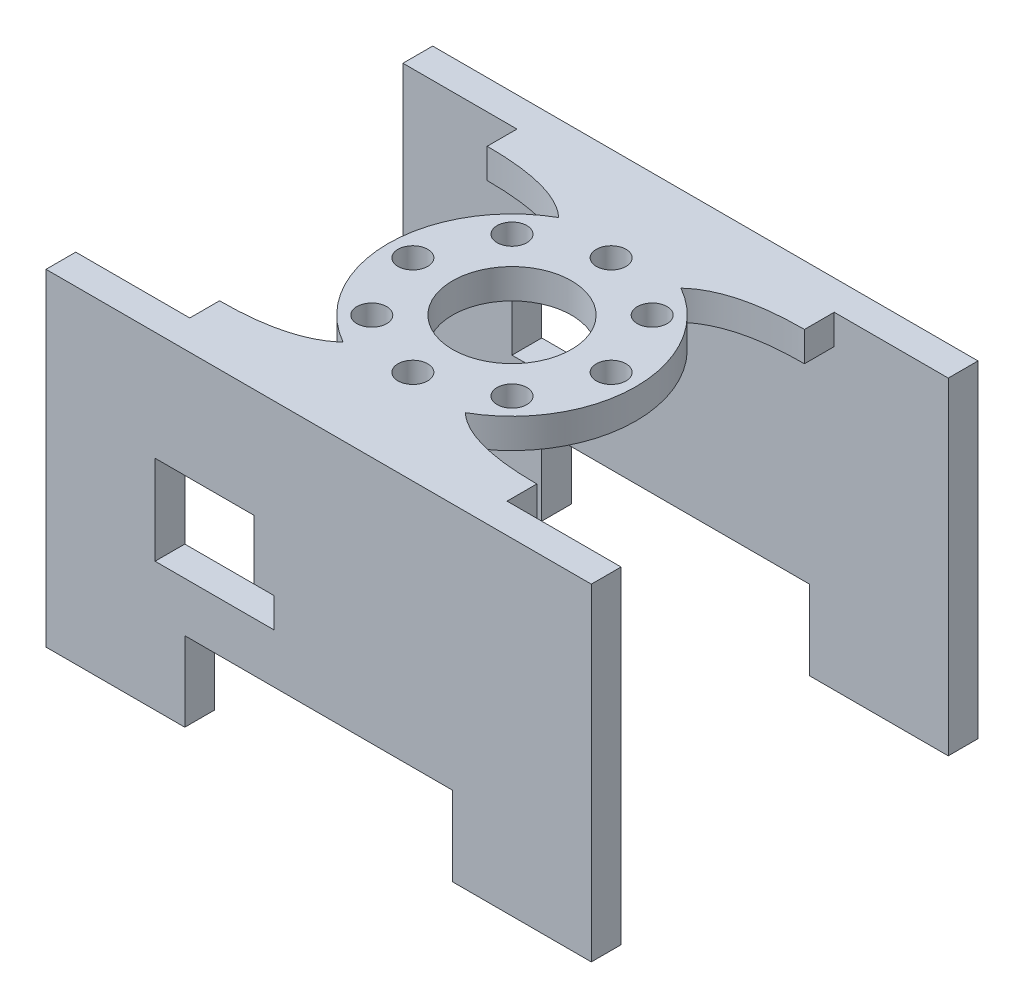
from build123d import *

# Parameters (mm, degrees)
ESQUISSE1_W                = 55
ESQUISSE1_H                = 33
BOSS_EXTRU_1_DEPTH         = 3
ENL_V_MAT_EXTRU_1_REACH    = 66.211
ENL_V_MAT_EXTRU_2_REACH    = 66.211
ESQUISSE4_W                = 32
ESQUISSE4_H                = 3
BOSS_EXTRU_2_DEPTH         = 3
ENL_V_MAT_EXTRU_3_REACH    = 74.132
ESQUISSE5_R                = 1.5
R_P_TITION_LIN_AIRE1_COUNT = 2
R_P_TITION_LIN_AIRE1_PITCH = 36


with BuildPart() as part:
    # Esquisse1 → Boss.-Extru.1 (new body)
    with BuildSketch(Plane.XY):
        with Locations((27.5, 16.5)):
            Rectangle(ESQUISSE1_W, ESQUISSE1_H)
    boss_extru_1 = extrude(amount=BOSS_EXTRU_1_DEPTH)

    # Esquisse2 → Enlèv. mat.-Extru.1 (cut, up to next)
    with BuildSketch(Plane.XY.offset(3), mode=Mode.PRIVATE) as enl_v_mat_extru_1_sk1:
        Polygon((27.5, 8), (41, 8), (41, 0), (14, 0), (14, 8), align=None)
    enl_v_mat_extru_1_tool1 = extrude(enl_v_mat_extru_1_sk1.sketch, amount=-ENL_V_MAT_EXTRU_1_REACH, mode=Mode.PRIVATE) & part.part
    enl_v_mat_extru_1 = enl_v_mat_extru_1_tool1.solids().sort_by_distance((27.5, 4, 3))[0]
    add(enl_v_mat_extru_1, mode=Mode.SUBTRACT)

    # Esquisse3 → Enlèv. mat.-Extru.2 (cut, up to next)
    with BuildSketch(Plane.XY.offset(3), mode=Mode.PRIVATE) as enl_v_mat_extru_2_sk1:
        Polygon((11, 22), (21, 22), (21, 16), (23, 16), (23, 13), (11, 13), (11, 16), align=None)
    enl_v_mat_extru_2_tool1 = extrude(enl_v_mat_extru_2_sk1.sketch, amount=-ENL_V_MAT_EXTRU_2_REACH, mode=Mode.PRIVATE) & part.part
    enl_v_mat_extru_2 = enl_v_mat_extru_2_tool1.solids().sort_by_distance((16.375, 17.3125, 3))[0]
    add(enl_v_mat_extru_2, mode=Mode.SUBTRACT)

    # Esquisse4 → Boss.-Extru.2 (add)
    with BuildSketch(Plane(origin=(0, 33, 0), x_dir=(1, 0, 0), z_dir=(0, 1, 0))):
        Polygon((11.5, 0), (27.5, 0), (43.5, 0), (43.5, 3), (11.5, 3), align=None)
        with BuildLine():
            add(Edge.make_bspline(
                [(11.5, 3), (18.557221365, 3), (21.334379392, 5.626402504)],
                knots=[0, 0, 0, 0.441076335, 0.441076335, 0.441076335], degree=2))
            Line((11.5, 3), (43.5, 3))
            add(Edge.make_bspline(
                [(43.5, 3), (36.442778635, 3), (33.665620608, 5.626402504)],
                knots=[0, 0, 0, 0.441076335, 0.441076335, 0.441076335], degree=2))
            ThreePointArc((33.665620608, 5.626402504), (27.5, 4), (21.334379392, 5.626402504))
        make_face()
        with BuildLine():
            add(Edge.make_bspline(
                [(21.334379392, 5.626402504), (23.913128098, 8.065166158), (22.80153106, 12.768460155)],
                knots=[0.441076335, 0.441076335, 0.441076335, 0.850640724, 0.850640724, 0.850640724], degree=2))
            ThreePointArc((21.334379392, 5.626402504), (27.5, 4), (33.665620608, 5.626402504))
            add(Edge.make_bspline(
                [(33.665620608, 5.626402504), (31.086871902, 8.065166158), (32.19846894, 12.768460155)],
                knots=[0.441076335, 0.441076335, 0.441076335, 0.850640724, 0.850640724, 0.850640724], degree=2))
            ThreePointArc((32.19846894, 12.768460155), (27.5, 10.5), (22.80153106, 12.768460155))
        make_face()
        with BuildLine():
            add(Edge.make_bspline(
                [(33.665620608, 5.626402504), (31.086871902, 8.065166158), (32.19846894, 12.768460155)],
                knots=[0.441076335, 0.441076335, 0.441076335, 0.850640724, 0.850640724, 0.850640724], degree=2))
            ThreePointArc((33.665620608, 5.626402504), (38.300931849, 10.207951749), (40, 16.5))
            ThreePointArc((40, 16.5), (38.300931849, 22.792048251), (33.665620608, 27.373597496))
            add(Edge.make_bspline(
                [(33.665620608, 27.373597496), (31.086871902, 24.934833842), (32.19846894, 20.231539845)],
                knots=[0.441076335, 0.441076335, 0.441076335, 0.850640724, 0.850640724, 0.850640724], degree=2))
            ThreePointArc((32.19846894, 20.231539845), (33.165280825, 18.476004347), (33.5, 16.5))
            ThreePointArc((33.5, 16.5), (33.165280825, 14.523995653), (32.19846894, 12.768460155))
        make_face()
        with BuildLine():
            ThreePointArc((21.334379392, 27.373597496), (15, 16.5), (21.334379392, 5.626402504))
            add(Edge.make_bspline(
                [(21.334379392, 5.626402504), (23.913128098, 8.065166158), (22.80153106, 12.768460155)],
                knots=[0.441076335, 0.441076335, 0.441076335, 0.850640724, 0.850640724, 0.850640724], degree=2))
            ThreePointArc((22.80153106, 12.768460155), (21.834719175, 14.523995653), (21.5, 16.5))
            ThreePointArc((21.5, 16.5), (21.834719175, 18.476004347), (22.80153106, 20.231539845))
            add(Edge.make_bspline(
                [(21.334379392, 27.373597496), (23.913128098, 24.934833842), (22.80153106, 20.231539845)],
                knots=[0.441076335, 0.441076335, 0.441076335, 0.850640724, 0.850640724, 0.850640724], degree=2))
        make_face()
        with BuildLine():
            ThreePointArc((33.665620608, 27.373597496), (27.5, 29), (21.334379392, 27.373597496))
            add(Edge.make_bspline(
                [(21.334379392, 27.373597496), (23.913128098, 24.934833842), (22.80153106, 20.231539845)],
                knots=[0.441076335, 0.441076335, 0.441076335, 0.850640724, 0.850640724, 0.850640724], degree=2))
            ThreePointArc((22.80153106, 20.231539845), (27.5, 22.5), (32.19846894, 20.231539845))
            add(Edge.make_bspline(
                [(33.665620608, 27.373597496), (31.086871902, 24.934833842), (32.19846894, 20.231539845)],
                knots=[0.441076335, 0.441076335, 0.441076335, 0.850640724, 0.850640724, 0.850640724], degree=2))
        make_face()
        with BuildLine():
            add(Edge.make_bspline(
                [(11.5, 30), (18.557221365, 30), (21.334379392, 27.373597496)],
                knots=[0, 0, 0, 0.441076335, 0.441076335, 0.441076335], degree=2))
            ThreePointArc((21.334379392, 27.373597496), (27.5, 29), (33.665620608, 27.373597496))
            add(Edge.make_bspline(
                [(43.5, 30), (36.442778635, 30), (33.665620608, 27.373597496)],
                knots=[0, 0, 0, 0.441076335, 0.441076335, 0.441076335], degree=2))
            Line((43.5, 30), (11.5, 30))
        make_face()
        with Locations((27.5, 31.5)):
            Rectangle(ESQUISSE4_W, ESQUISSE4_H)
    extrude(amount=-BOSS_EXTRU_2_DEPTH)

    # Esquisse5 → Enlèv. mat.-Extru.3 (cut, up to next)
    with BuildSketch(Plane(origin=(0, 33, 0), x_dir=(1, 0, 0), z_dir=(0, 1, 0)), mode=Mode.PRIVATE) as enl_v_mat_extru_3_sk1:
        with Locations(Location((27.5, 26.5, 0), (0, 0, 270))):
            Circle(ESQUISSE5_R)
    enl_v_mat_extru_3_tool1 = extrude(enl_v_mat_extru_3_sk1.sketch, amount=-ENL_V_MAT_EXTRU_3_REACH, mode=Mode.PRIVATE) & part.part
    # Esquisse5 → Enlèv. mat.-Extru.3 (cut, up to next)
    with BuildSketch(Plane(origin=(0, 33, 0), x_dir=(1, 0, 0), z_dir=(0, 1, 0)), mode=Mode.PRIVATE) as enl_v_mat_extru_3_sk2:
        with Locations(Location((20.428932188, 23.571067812, 0), (0, 0, 270))):
            Circle(ESQUISSE5_R)
    enl_v_mat_extru_3_tool2 = extrude(enl_v_mat_extru_3_sk2.sketch, amount=-ENL_V_MAT_EXTRU_3_REACH, mode=Mode.PRIVATE) & part.part
    # Esquisse5 → Enlèv. mat.-Extru.3 (cut, up to next)
    with BuildSketch(Plane(origin=(0, 33, 0), x_dir=(1, 0, 0), z_dir=(0, 1, 0)), mode=Mode.PRIVATE) as enl_v_mat_extru_3_sk3:
        with Locations(Location((17.5, 16.5, 0), (0, 0, 270))):
            Circle(ESQUISSE5_R)
    enl_v_mat_extru_3_tool3 = extrude(enl_v_mat_extru_3_sk3.sketch, amount=-ENL_V_MAT_EXTRU_3_REACH, mode=Mode.PRIVATE) & part.part
    # Esquisse5 → Enlèv. mat.-Extru.3 (cut, up to next)
    with BuildSketch(Plane(origin=(0, 33, 0), x_dir=(1, 0, 0), z_dir=(0, 1, 0)), mode=Mode.PRIVATE) as enl_v_mat_extru_3_sk4:
        with Locations(Location((27.5, 6.5, 0), (0, 0, 270))):
            Circle(ESQUISSE5_R)
    enl_v_mat_extru_3_tool4 = extrude(enl_v_mat_extru_3_sk4.sketch, amount=-ENL_V_MAT_EXTRU_3_REACH, mode=Mode.PRIVATE) & part.part
    # Esquisse5 → Enlèv. mat.-Extru.3 (cut, up to next)
    with BuildSketch(Plane(origin=(0, 33, 0), x_dir=(1, 0, 0), z_dir=(0, 1, 0)), mode=Mode.PRIVATE) as enl_v_mat_extru_3_sk5:
        with Locations(Location((34.571067812, 9.428932188, 0), (0, 0, 270))):
            Circle(ESQUISSE5_R)
    enl_v_mat_extru_3_tool5 = extrude(enl_v_mat_extru_3_sk5.sketch, amount=-ENL_V_MAT_EXTRU_3_REACH, mode=Mode.PRIVATE) & part.part
    # Esquisse5 → Enlèv. mat.-Extru.3 (cut, up to next)
    with BuildSketch(Plane(origin=(0, 33, 0), x_dir=(1, 0, 0), z_dir=(0, 1, 0)), mode=Mode.PRIVATE) as enl_v_mat_extru_3_sk6:
        with Locations(Location((37.5, 16.5, 0), (0, 0, 270))):
            Circle(ESQUISSE5_R)
    enl_v_mat_extru_3_tool6 = extrude(enl_v_mat_extru_3_sk6.sketch, amount=-ENL_V_MAT_EXTRU_3_REACH, mode=Mode.PRIVATE) & part.part
    # Esquisse5 → Enlèv. mat.-Extru.3 (cut, up to next)
    with BuildSketch(Plane(origin=(0, 33, 0), x_dir=(1, 0, 0), z_dir=(0, 1, 0)), mode=Mode.PRIVATE) as enl_v_mat_extru_3_sk7:
        with Locations(Location((34.571067812, 23.571067812, 0), (0, 0, 270))):
            Circle(ESQUISSE5_R)
    enl_v_mat_extru_3_tool7 = extrude(enl_v_mat_extru_3_sk7.sketch, amount=-ENL_V_MAT_EXTRU_3_REACH, mode=Mode.PRIVATE) & part.part
    # Esquisse5 → Enlèv. mat.-Extru.3 (cut, up to next)
    with BuildSketch(Plane(origin=(0, 33, 0), x_dir=(1, 0, 0), z_dir=(0, 1, 0)), mode=Mode.PRIVATE) as enl_v_mat_extru_3_sk8:
        with Locations(Location((20.428932188, 9.428932188, 0), (0, 0, 270))):
            Circle(ESQUISSE5_R)
    enl_v_mat_extru_3_tool8 = extrude(enl_v_mat_extru_3_sk8.sketch, amount=-ENL_V_MAT_EXTRU_3_REACH, mode=Mode.PRIVATE) & part.part
    add(enl_v_mat_extru_3_tool1.solids().sort_by_distance((27.5, 33, -26.5))[0], mode=Mode.SUBTRACT)
    add(enl_v_mat_extru_3_tool2.solids().sort_by_distance((20.428932, 33, -23.571068))[0], mode=Mode.SUBTRACT)
    add(enl_v_mat_extru_3_tool3.solids().sort_by_distance((17.5, 33, -16.5))[0], mode=Mode.SUBTRACT)
    add(enl_v_mat_extru_3_tool4.solids().sort_by_distance((27.5, 33, -6.5))[0], mode=Mode.SUBTRACT)
    add(enl_v_mat_extru_3_tool5.solids().sort_by_distance((34.571068, 33, -9.428932))[0], mode=Mode.SUBTRACT)
    add(enl_v_mat_extru_3_tool6.solids().sort_by_distance((37.5, 33, -16.5))[0], mode=Mode.SUBTRACT)
    add(enl_v_mat_extru_3_tool7.solids().sort_by_distance((34.571068, 33, -23.571068))[0], mode=Mode.SUBTRACT)
    add(enl_v_mat_extru_3_tool8.solids().sort_by_distance((20.428932, 33, -9.428932))[0], mode=Mode.SUBTRACT)

    # Répétition linéaire1: Boss.-Extru.1, Enlèv. mat.-Extru.1, Enlèv. mat.-Extru.2 ×2
    with Locations(*[(0, 0, -i * R_P_TITION_LIN_AIRE1_PITCH) for i in range(1, R_P_TITION_LIN_AIRE1_COUNT)]):
        add(boss_extru_1)
        add(enl_v_mat_extru_1, mode=Mode.SUBTRACT)
        add(enl_v_mat_extru_2, mode=Mode.SUBTRACT)


solid = part.part
